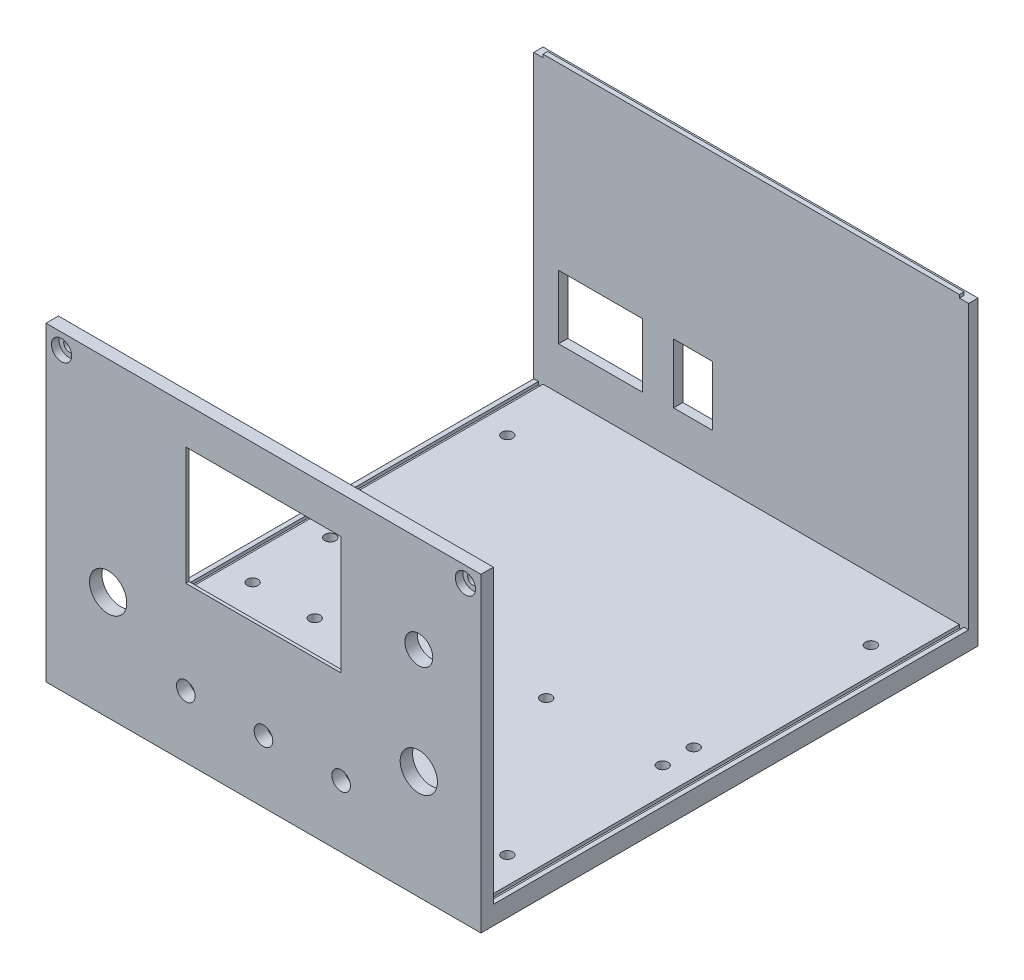
from build123d import *

# Parameters (mm, degrees)
SKETCH_1_W                  = 140
SKETCH_1_H                  = 160
EXTRUDE_1_DEPTH             = 6
SKETCH_3_W                  = 140
SKETCH_3_H                  = 4
SKETCH_3_H_2                = 3
EXTRUDE_3_DEPTH             = 94
CUT_EXTRUDE_1_DEPTH         = 190.73665961
SKETCH_5_W                  = 1.5
SKETCH_5_H                  = 153
CUT_EXTRUDE_2_DEPTH         = 1
HOLE_WIZARD_M21_D           = 3.5
HOLE_WIZARD_M21_DEPTH       = 3
CUT_EXTRUDE_3_REACH         = 203.246
SKETCH_9_R                  = 3
SKETCH_9_R_2                = 4.5
SKETCH_9_R_3                = 6
SKETCH_9_W                  = 50
SKETCH_9_H                  = 38
SKETCH_10_W                 = 54
SKETCH_10_H                 = 48
CUT_EXTRUDE_4_DEPTH         = 3
SKETCH_11_W                 = 2.5
SKETCH_11_H                 = 1.5
SKETCH_11_W_2               = 3
SKETCH_11_H_2               = 2
CUT_EXTRUDE_5_DEPTH         = 2.5
HOLE_WIZARD_M31_D           = 3.4
HOLE_WIZARD_M31_DEPTH       = 4
HOLE_WIZARD_M31_CBORE_D     = 6.5
HOLE_WIZARD_M31_CBORE_DEPTH = 2.4
CUT_EXTRUDE_6_REACH         = 203.246
SKETCH_15_W                 = 12.5
SKETCH_15_H                 = 19.2
SKETCH_15_W_2               = 27
SKETCH_15_H_2               = 20.5
HOLE_WIZARD_M22_D           = 2.2
HOLE_WIZARD_M22_DEPTH       = 1
HOLE_WIZARD_M23_D           = 3.5
HOLE_WIZARD_M23_DEPTH       = 3
CUT_EXTRUDE_7_REACH         = 202.056
SKETCH_24_W                 = 3
SKETCH_24_H                 = 1


with BuildPart() as part:
    # Эскиз1 → Бобышка-Вытянуть1 (new body)
    with BuildSketch(Plane(origin=(0, 0, 0), x_dir=(1, 0, 0), z_dir=(0, 1, 0))):
        Rectangle(SKETCH_1_W, SKETCH_1_H)
    extrude(amount=EXTRUDE_1_DEPTH)

    # Эскиз3 → Бобышка-Вытянуть3 (add)
    with BuildSketch(Plane(origin=(0, 6, 0), x_dir=(1, 0, 0), z_dir=(0, 1, 0))):
        with Locations((0, -78)):
            Rectangle(SKETCH_3_W, SKETCH_3_H)
        with Locations((0, 78.5)):
            Rectangle(SKETCH_3_W, SKETCH_3_H_2)
    extrude(amount=EXTRUDE_3_DEPTH)

    # Эскиз4 → Вырез-Вытянуть1 (cut, through all)
    with BuildSketch(Plane(origin=(70, 0, 0), x_dir=(0, 0, -1), z_dir=(1, 0, 0))):
        Polygon((80, 100), (80, 97), (78.5, 97), (78.5, 98), (77, 98), (77, 100), align=None)
    extrude(amount=-CUT_EXTRUDE_1_DEPTH, mode=Mode.SUBTRACT)

    # Эскиз5 → Вырез-Вытянуть2 (cut)
    with BuildSketch(Plane(origin=(0, 6, 0), x_dir=(1, 0, 0), z_dir=(0, 1, 0))):
        with Locations((67.75, 0.5)):
            Rectangle(SKETCH_5_W, SKETCH_5_H)
        with Locations((-67.75, 0.5)):
            Rectangle(SKETCH_5_W, SKETCH_5_H)
    extrude(amount=-CUT_EXTRUDE_2_DEPTH, mode=Mode.SUBTRACT)

    # Отверстие с зазором M21
    with Locations(Plane(origin=(0, 6, 0), x_dir=(1, 0, 0), z_dir=(0, 1, 0))):
        with Locations((-58.5, -25), (-38.5, -25), (-38.5, -50), (-58.5, -50), (-18.875, -25), (1.125, -25), (-18.875, -50), (1.125, -50), (21, -10), (21, -60), (58.5, -60), (58.5, -10), (-58.5, 57), (-58.5, 0), (58.5, 0), (58.5, 57)):
            Hole(HOLE_WIZARD_M21_D / 2, depth=HOLE_WIZARD_M21_DEPTH)

    # Эскиз9 → Вырез-Вытянуть3 (cut, up to next)
    with BuildSketch(Plane.XY.offset(80), mode=Mode.PRIVATE) as cut_extrude_3_sk1:
        with Locations((-25, 20)):
            Circle(SKETCH_9_R)
    cut_extrude_3_tool1 = extrude(cut_extrude_3_sk1.sketch, amount=-CUT_EXTRUDE_3_REACH, mode=Mode.PRIVATE) & part.part
    # Эскиз9 → Вырез-Вытянуть3 (cut, up to next)
    with BuildSketch(Plane.XY.offset(80), mode=Mode.PRIVATE) as cut_extrude_3_sk2:
        with Locations((0, 20)):
            Circle(SKETCH_9_R)
    cut_extrude_3_tool2 = extrude(cut_extrude_3_sk2.sketch, amount=-CUT_EXTRUDE_3_REACH, mode=Mode.PRIVATE) & part.part
    # Эскиз9 → Вырез-Вытянуть3 (cut, up to next)
    with BuildSketch(Plane.XY.offset(80), mode=Mode.PRIVATE) as cut_extrude_3_sk3:
        with Locations((25, 20)):
            Circle(SKETCH_9_R)
    cut_extrude_3_tool3 = extrude(cut_extrude_3_sk3.sketch, amount=-CUT_EXTRUDE_3_REACH, mode=Mode.PRIVATE) & part.part
    # Эскиз9 → Вырез-Вытянуть3 (cut, up to next)
    with BuildSketch(Plane.XY.offset(80), mode=Mode.PRIVATE) as cut_extrude_3_sk4:
        with Locations((50, 69)):
            Circle(SKETCH_9_R_2)
    cut_extrude_3_tool4 = extrude(cut_extrude_3_sk4.sketch, amount=-CUT_EXTRUDE_3_REACH, mode=Mode.PRIVATE) & part.part
    # Эскиз9 → Вырез-Вытянуть3 (cut, up to next)
    with BuildSketch(Plane.XY.offset(80), mode=Mode.PRIVATE) as cut_extrude_3_sk5:
        with Locations((50, 35)):
            Circle(SKETCH_9_R_3)
    cut_extrude_3_tool5 = extrude(cut_extrude_3_sk5.sketch, amount=-CUT_EXTRUDE_3_REACH, mode=Mode.PRIVATE) & part.part
    # Эскиз9 → Вырез-Вытянуть3 (cut, up to next)
    with BuildSketch(Plane.XY.offset(80), mode=Mode.PRIVATE) as cut_extrude_3_sk6:
        with Locations(Location((-50, 35, 0), (0, 0, 180))):
            Circle(SKETCH_9_R_3)
    cut_extrude_3_tool6 = extrude(cut_extrude_3_sk6.sketch, amount=-CUT_EXTRUDE_3_REACH, mode=Mode.PRIVATE) & part.part
    # Эскиз9 → Вырез-Вытянуть3 (cut, up to next)
    with BuildSketch(Plane.XY.offset(80), mode=Mode.PRIVATE) as cut_extrude_3_sk7:
        with Locations((0, 69)):
            Rectangle(SKETCH_9_W, SKETCH_9_H)
    cut_extrude_3_tool7 = extrude(cut_extrude_3_sk7.sketch, amount=-CUT_EXTRUDE_3_REACH, mode=Mode.PRIVATE) & part.part
    add(cut_extrude_3_tool1.solids().sort_by_distance((-25, 20, 80))[0], mode=Mode.SUBTRACT)
    add(cut_extrude_3_tool2.solids().sort_by_distance((0, 20, 80))[0], mode=Mode.SUBTRACT)
    add(cut_extrude_3_tool3.solids().sort_by_distance((25, 20, 80))[0], mode=Mode.SUBTRACT)
    add(cut_extrude_3_tool4.solids().sort_by_distance((50, 69, 80))[0], mode=Mode.SUBTRACT)
    add(cut_extrude_3_tool5.solids().sort_by_distance((50, 35, 80))[0], mode=Mode.SUBTRACT)
    add(cut_extrude_3_tool6.solids().sort_by_distance((-50, 35, 80))[0], mode=Mode.SUBTRACT)
    add(cut_extrude_3_tool7.solids().sort_by_distance((0, 69, 80))[0], mode=Mode.SUBTRACT)

    # Эскиз10 → Вырез-Вытянуть4 (cut)
    with BuildSketch(Plane(origin=(0, 0, 76), x_dir=(-1, 0, 0), z_dir=(0, 0, -1))):
        with Locations((2, 69)):
            Rectangle(SKETCH_10_W, SKETCH_10_H)
    extrude(amount=-CUT_EXTRUDE_4_DEPTH, mode=Mode.SUBTRACT)

    # Эскиз11 → Вырез-Вытянуть5 (cut)
    with BuildSketch(Plane(origin=(0, 0, 76), x_dir=(-1, 0, 0), z_dir=(0, 0, -1))):
        with Locations((0, 26.618347297)):
            Rectangle(SKETCH_11_W, SKETCH_11_H)
        with Locations((-25, 26.618347297)):
            Rectangle(SKETCH_11_W, SKETCH_11_H)
        with Locations((25, 26.618347297)):
            Rectangle(SKETCH_11_W, SKETCH_11_H)
        with Locations((-50, 78.5)):
            Rectangle(SKETCH_11_W_2, SKETCH_11_H_2)
    extrude(amount=-CUT_EXTRUDE_5_DEPTH, mode=Mode.SUBTRACT)

    # Цековка для винта с внутренним шестигранником с тонкой головкой M31
    with Locations(Plane.XY.offset(80)):
        with Locations((-65, 95), (65, 95)):
            CounterBoreHole(HOLE_WIZARD_M31_D / 2, HOLE_WIZARD_M31_CBORE_D / 2, HOLE_WIZARD_M31_CBORE_DEPTH, depth=HOLE_WIZARD_M31_DEPTH)

    # Эскиз15 → Вырез-Вытянуть6 (cut, up to next)
    with BuildSketch(Plane(origin=(0, 0, -80), x_dir=(-1, 0, 0), z_dir=(0, 0, -1)), mode=Mode.PRIVATE) as cut_extrude_6_sk1:
        with Locations((18.75, 30)):
            Rectangle(SKETCH_15_W, SKETCH_15_H)
    cut_extrude_6_tool1 = extrude(cut_extrude_6_sk1.sketch, amount=-CUT_EXTRUDE_6_REACH, mode=Mode.PRIVATE) & part.part
    # Эскиз15 → Вырез-Вытянуть6 (cut, up to next)
    with BuildSketch(Plane(origin=(0, 0, -80), x_dir=(-1, 0, 0), z_dir=(0, 0, -1)), mode=Mode.PRIVATE) as cut_extrude_6_sk2:
        with Locations((48.5, 30)):
            Rectangle(SKETCH_15_W_2, SKETCH_15_H_2)
    cut_extrude_6_tool2 = extrude(cut_extrude_6_sk2.sketch, amount=-CUT_EXTRUDE_6_REACH, mode=Mode.PRIVATE) & part.part
    add(cut_extrude_6_tool1.solids().sort_by_distance((-18.75, 30, -80))[0], mode=Mode.SUBTRACT)
    add(cut_extrude_6_tool2.solids().sort_by_distance((-48.5, 30, -80))[0], mode=Mode.SUBTRACT)

    # Отверстие с зазором M22
    with Locations(Plane(origin=(0, 3, 0), x_dir=(1, 0, 0), z_dir=(0, 1, 0))):
        with Locations((-58.5, -50), (-38.5, -50), (-18.875, -50), (1.125, -50), (1.125, -25), (-18.875, -25), (-38.5, -25), (-58.5, -25), (21, -10), (21, -60), (58.5, -60), (58.5, -10), (58.5, 0), (-58.5, 0), (58.5, 57), (-58.5, 57)):
            Hole(HOLE_WIZARD_M22_D / 2, depth=HOLE_WIZARD_M22_DEPTH)

    # Отверстие с зазором M23
    with Locations(Plane(origin=(0, 0, 76), x_dir=(-1, 0, 0), z_dir=(0, 0, -1))):
        with Locations((-28.9, 86), (-28.9, 51.75), (32.35, 86), (32.35, 51.75)):
            Hole(HOLE_WIZARD_M23_D / 2, depth=HOLE_WIZARD_M23_DEPTH)

    # Эскиз24 → Вырез-Вытянуть7 (cut, up to next)
    with BuildSketch(Plane(origin=(0, 0, -78.5), x_dir=(-1, 0, 0), z_dir=(0, 0, -1)), mode=Mode.PRIVATE) as cut_extrude_7_sk1:
        with Locations((-68.5, 97.5)):
            Rectangle(SKETCH_24_W, SKETCH_24_H)
    cut_extrude_7_tool1 = extrude(cut_extrude_7_sk1.sketch, amount=-CUT_EXTRUDE_7_REACH, mode=Mode.PRIVATE) & part.part
    # Эскиз24 → Вырез-Вытянуть7 (cut, up to next)
    with BuildSketch(Plane(origin=(0, 0, -78.5), x_dir=(-1, 0, 0), z_dir=(0, 0, -1)), mode=Mode.PRIVATE) as cut_extrude_7_sk2:
        with Locations((68.5, 97.5)):
            Rectangle(SKETCH_24_W, SKETCH_24_H)
    cut_extrude_7_tool2 = extrude(cut_extrude_7_sk2.sketch, amount=-CUT_EXTRUDE_7_REACH, mode=Mode.PRIVATE) & part.part
    add(cut_extrude_7_tool1.solids().sort_by_distance((68.5, 97.5, -78.5))[0], mode=Mode.SUBTRACT)
    add(cut_extrude_7_tool2.solids().sort_by_distance((-68.5, 97.5, -78.5))[0], mode=Mode.SUBTRACT)


solid = part.part
